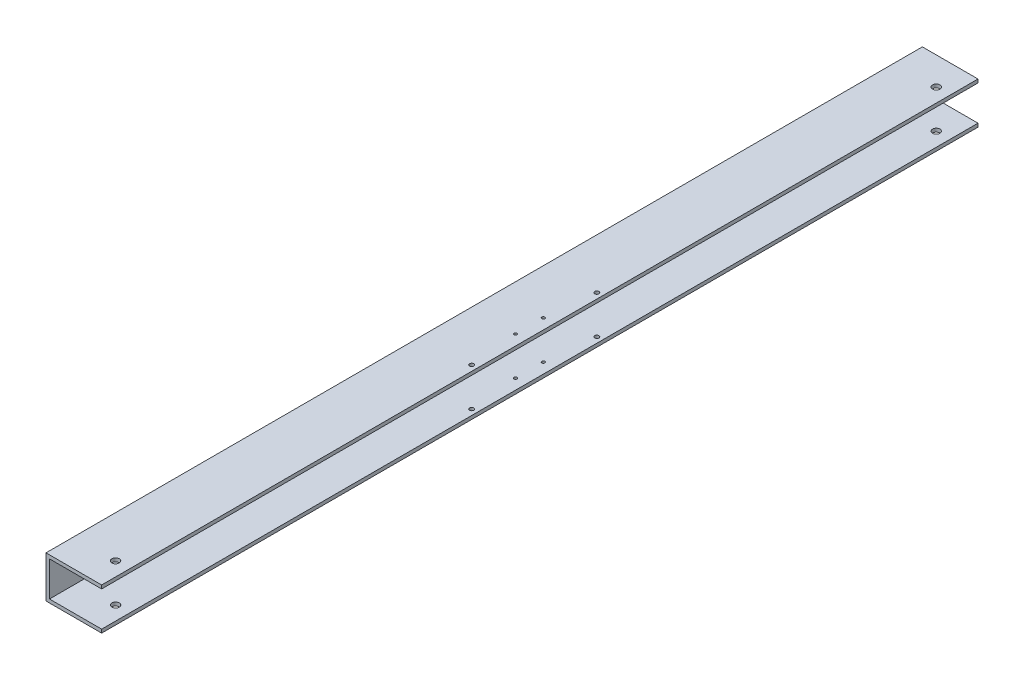
from build123d import *

# Parameters (mm, degrees)
BOSS_EXTRUDE1_DEPTH         = 400.05
F_6_32_TAPPED_HOLE1_D       = 2.7051
F_6_CLEARANCE_HOLE1_D       = 3.7973
F_1_4_CLEARANCE_HOLE1_D     = 6.7564
F_1_4_CLEARANCE_HOLE1_DEPTH = 3.175
MIRROR3_COPY_1_D            = 6.7564
MIRROR3_COPY_1_DEPTH        = 3.175


with BuildPart() as part:
    # Sketch1 → Boss-Extrude1 (new, symmetric)
    with BuildSketch(Plane.XY):
        Polygon((-22.225, -15.875), (25.4, -15.875), (25.4, -19.05), (-25.4, -19.05), (-25.4, 19.05), (25.4, 19.05), (25.4, 15.875), (-22.225, 15.875), align=None)
    extrude(amount=BOSS_EXTRUDE1_DEPTH, both=True)

    # #6-32 Tapped Hole1 (through all)
    with Locations(Plane(origin=(0, 19.05, 0), x_dir=(1, 0, 0), z_dir=(0, 1, 0))):
        with Locations((15.875, -12.7)):
            f_6_32_tapped_hole1 = Hole(F_6_32_TAPPED_HOLE1_D / 2)

    # #6 Clearance Hole1 (through all)
    with Locations(Plane(origin=(0, 19.05, 0), x_dir=(1, 0, 0), z_dir=(0, 1, 0))):
        with Locations((20.32, -57.15)):
            f_6_clearance_hole1 = Hole(F_6_CLEARANCE_HOLE1_D / 2)

    # 1/4 Clearance Hole1
    with Locations(Plane(origin=(0, -19.05, 0), x_dir=(-1, 0, 0), z_dir=(0, -1, 0))):
        with Locations((-12.7, -374.65)):
            f_1_4_clearance_hole1 = Hole(F_1_4_CLEARANCE_HOLE1_D / 2, depth=F_1_4_CLEARANCE_HOLE1_DEPTH)

    # Mirror2: 1/4 Clearance Hole1 across plane
    add(f_1_4_clearance_hole1.mirror(Plane.ZX), mode=Mode.SUBTRACT)

    # Mirror3: 1/4 Clearance Hole1 across plane
    add(f_1_4_clearance_hole1.mirror(Plane.XY), mode=Mode.SUBTRACT)

    # Mirror3 copy 1
    with Locations(Plane(origin=(0, 19.05, 0), x_dir=(-1, 0, 0), z_dir=(0, 1, 0))):
        with Locations((-12.7, -374.65)):
            Hole(MIRROR3_COPY_1_D / 2, depth=MIRROR3_COPY_1_DEPTH)

    # Mirror4: #6-32 Tapped Hole1, #6 Clearance Hole1 across plane
    add(f_6_32_tapped_hole1.mirror(Plane.XY), mode=Mode.SUBTRACT)
    add(f_6_clearance_hole1.mirror(Plane.XY), mode=Mode.SUBTRACT)


solid = part.part
